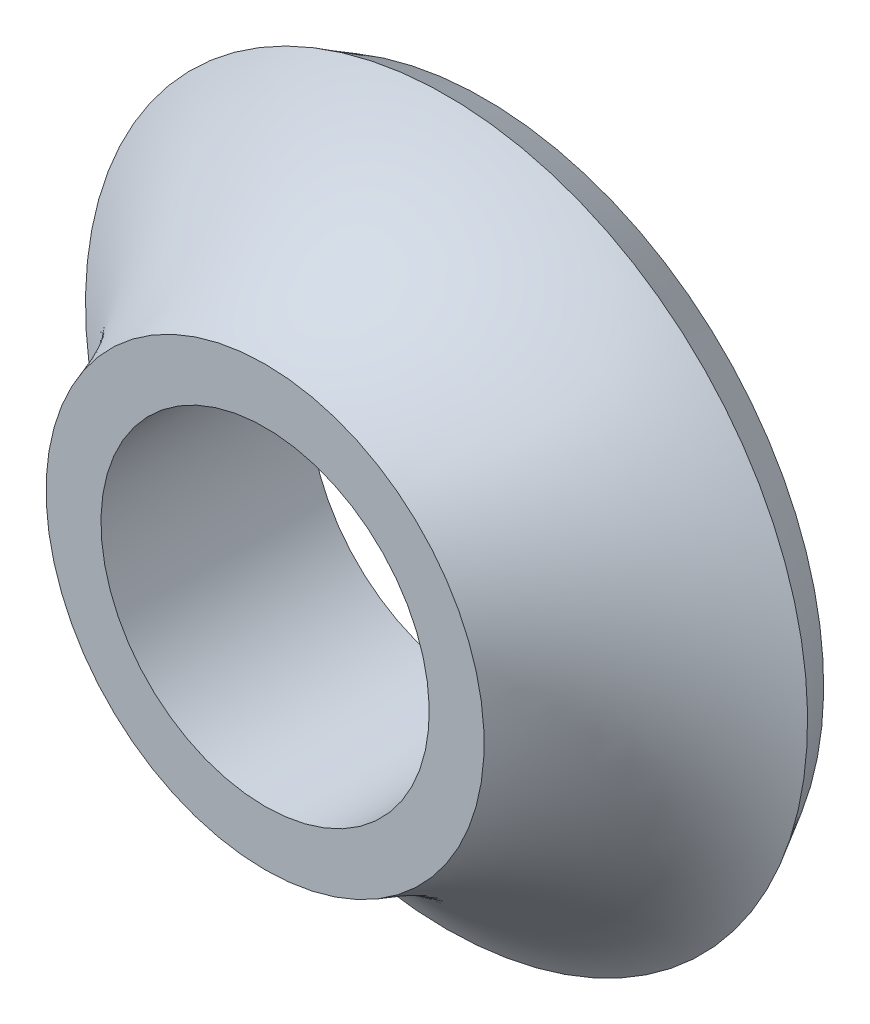
from build123d import *

# Parameters (mm, degrees)
CUT_EXTRUDE1_REACH             = 24.669
SKETCH2_R                      = 0.9525
CUT_EXTRUDE1_DIRECTION_2_REACH = 24.669


with BuildPart() as part:
    # Sketch3 → Revolve1 (revolve)
    with BuildSketch(Plane(origin=(0, 0, 0), x_dir=(0, 0, -1), z_dir=(1, 0, 0)), mode=Mode.PRIVATE) as revolve1_sk:
        with BuildLine():
            Line((-4.7625, 7.1247), (-4.7625, 9.50595))
            ThreePointArc((-4.7625, 9.50595), (-0.2272742, 11.825581937), (3.112721606, 15.6718))
            Line((3.112721606, 15.6718), (4.7625, 14.7193))
            Line((4.7625, 14.7193), (2.305035487, 10.462846606))
            ThreePointArc((2.305035487, 10.462846606), (2.305035487, 9.824915535), (2.8575, 9.50595))
            Line((2.8575, 9.50595), (4.28625, 9.50595))
            Line((4.28625, 9.50595), (4.28625, 7.1247))
            Line((4.28625, 7.1247), (-4.7625, 7.1247))
        make_face()
    revolve(revolve1_sk.sketch.rotate(Axis((0, 0, 4.7625), (0, 0, -1)), 180), axis=Axis((0, 0, 4.7625), (0, 0, -1)))

    # Sketch2 → Cut-Extrude1 (cut, up to next)
    with BuildSketch(Plane(origin=(0, 0, 0), x_dir=(0, 0, -1), z_dir=(1, 0, 0)), mode=Mode.PRIVATE) as cut_extrude1_sk1:
        with Locations((4.7625, 0)):
            Circle(SKETCH2_R)
    cut_extrude1_tool1 = extrude(cut_extrude1_sk1.sketch, amount=-CUT_EXTRUDE1_REACH, mode=Mode.PRIVATE) & part.part
    add(cut_extrude1_tool1.solids().sort_by_distance((0, 0, -4.7625))[0], mode=Mode.SUBTRACT)

    # Sketch2 → Cut-Extrude1 direction 2 (cut, up to next)
    with BuildSketch(Plane(origin=(0, 0, 0), x_dir=(0, 0, -1), z_dir=(1, 0, 0)), mode=Mode.PRIVATE) as cut_extrude1_direction_2_sk1:
        with Locations((4.7625, 0)):
            Circle(SKETCH2_R)
    cut_extrude1_direction_2_tool1 = extrude(cut_extrude1_direction_2_sk1.sketch, amount=CUT_EXTRUDE1_DIRECTION_2_REACH, mode=Mode.PRIVATE) & part.part
    add(cut_extrude1_direction_2_tool1.solids().sort_by_distance((0, 0, -4.7625))[0], mode=Mode.SUBTRACT)


solid = part.part
